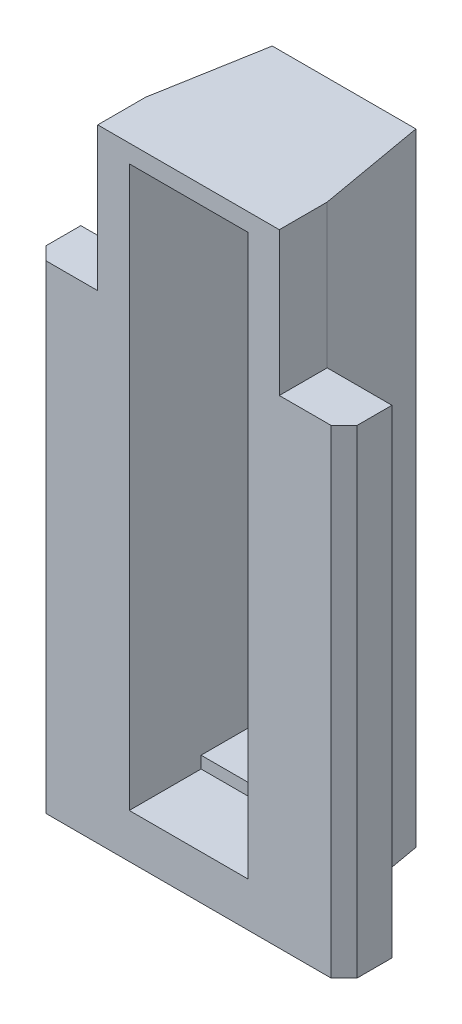
from build123d import *

# Parameters (mm, degrees)
EXTRUDE_1_DEPTH     = 40
EXTRUDE_2_DEPTH     = 12
CHAMFER_1_SIZE      = 1.1
SKETCH_3_W          = 9.9
SKETCH_3_H          = 45.3
CUT_EXTRUDE_1_DEPTH = 10
SKETCH_4_W          = 3.5
SKETCH_4_H          = 35
CUT_EXTRUDE_2_DEPTH = 55.525223521
SKETCH_5_W          = 9.9
SKETCH_5_H          = 0.5
SKETCH_5_H_2        = 1
CUT_EXTRUDE_3_DEPTH = 6
SKETCH_6_R          = 1.15
CUT_EXTRUDE_4_DEPTH = 55.525223521
SKETCH_7_R          = 1.95
CUT_EXTRUDE_5_DEPTH = 1.2


with BuildPart() as part:
    # 草图1 → 凸台-拉伸1 (new body)
    with BuildSketch(Plane(origin=(0, 0, 0), x_dir=(1, 0, 0), z_dir=(0, 1, 0))):
        Polygon((-13, 0), (13, 0), (13, 4), (7.586942826, 4), (6, 13), (-6, 13), (-7.586942826, 4), (-13, 4), align=None)
    extrude(amount=EXTRUDE_1_DEPTH)

    # 草图2 → 凸台-拉伸2 (add)
    with BuildSketch(Plane(origin=(0, 40, 0), x_dir=(1, 0, 0), z_dir=(0, 1, 0))):
        Polygon((7.586942826, 4), (6, 13), (-6, 13), (-7.586942826, 4), (-7.586942826, 0), (7.586942826, 0), align=None)
    extrude(amount=EXTRUDE_2_DEPTH)

    # 倒角1
    chamfer_1_edges = [part.edges().sort_by_distance(p)[0] for p in [
        (13, 20, 0),
        (-13, 20, 0),
    ]]
    chamfer(chamfer_1_edges, length=CHAMFER_1_SIZE)

    # 草图3 → 切除-拉伸1 (cut)
    with BuildSketch(Plane.XY):
        with Locations((0, 27.35)):
            Rectangle(SKETCH_3_W, SKETCH_3_H)
    extrude(amount=-CUT_EXTRUDE_1_DEPTH, mode=Mode.SUBTRACT)

    # 草图4 → 切除-拉伸2 (cut, through all)
    with BuildSketch(Plane.XY.offset(-10)):
        with Locations((0, 27.35)):
            Rectangle(SKETCH_4_W, SKETCH_4_H)
    extrude(amount=-CUT_EXTRUDE_2_DEPTH, mode=Mode.SUBTRACT)

    # 草图5 → 切除-拉伸3 (cut)
    with BuildSketch(Plane.XY):
        with Locations((0, 50.25)):
            Rectangle(SKETCH_5_W, SKETCH_5_H)
        with Locations((0, 4.2)):
            Rectangle(SKETCH_5_W, SKETCH_5_H_2)
    extrude(amount=-CUT_EXTRUDE_3_DEPTH, mode=Mode.SUBTRACT)

    # 草图6 → 切除-拉伸4 (cut, through all)
    with BuildSketch(Plane.XY.offset(-10)):
        with Locations((0, 47.85)):
            Circle(SKETCH_6_R)
        with Locations(Location((0, 6.85, 0), (0, 0, 180))):
            Circle(SKETCH_6_R)
    extrude(amount=-CUT_EXTRUDE_4_DEPTH, mode=Mode.SUBTRACT)

    # 草图7 → 切除-拉伸5 (cut)
    with BuildSketch(Plane(origin=(0, 0, -13), x_dir=(-1, 0, 0), z_dir=(0, 0, -1))):
        with Locations((0, 47.85)):
            Circle(SKETCH_7_R)
        with Locations((0, 6.85)):
            Circle(SKETCH_7_R)
    extrude(amount=-CUT_EXTRUDE_5_DEPTH, mode=Mode.SUBTRACT)


solid = part.part
